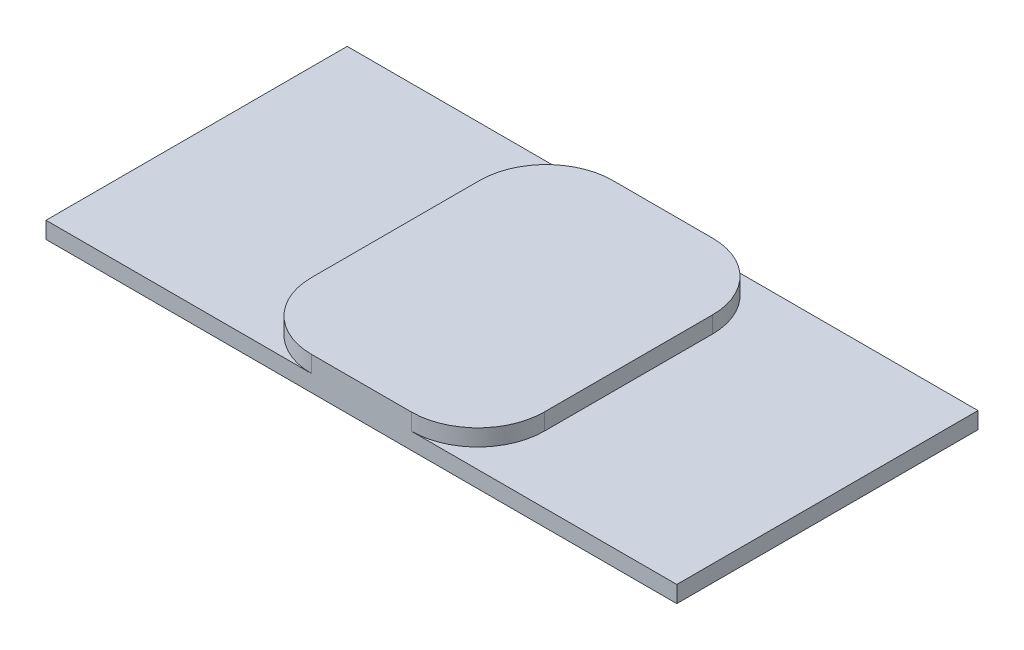
from build123d import *

# Parameters (mm, degrees)
SKETCH1_W           = 240.85
SKETCH1_H           = 115
BOSS_EXTRUDE1_DEPTH = 6.35
SKETCH2_W           = 88.9
SKETCH2_H           = 115
BOSS_EXTRUDE2_DEPTH = 6.35
FILLET1_R           = 25.4


with BuildPart() as part:
    # Sketch1 → Boss-Extrude1 (new body)
    with BuildSketch(Plane(origin=(0, 0, 0), x_dir=(1, 0, 0), z_dir=(0, 1, 0))):
        Rectangle(SKETCH1_W, SKETCH1_H)
    extrude(amount=BOSS_EXTRUDE1_DEPTH)

    # Sketch2 → Boss-Extrude2 (add)
    with BuildSketch(Plane(origin=(0, 6.35, 0), x_dir=(1, 0, 0), z_dir=(0, 1, 0))):
        Rectangle(SKETCH2_W, SKETCH2_H)
    extrude(amount=BOSS_EXTRUDE2_DEPTH)

    # Fillet1
    fillet1_edges = [part.edges().sort_by_distance(p)[0] for p in [
        (44.45, 9.525, 57.5),
        (44.45, 9.525, -57.5),
        (-44.45, 9.525, -57.5),
        (-44.45, 9.525, 57.5),
    ]]
    fillet(fillet1_edges, radius=FILLET1_R)


solid = part.part
